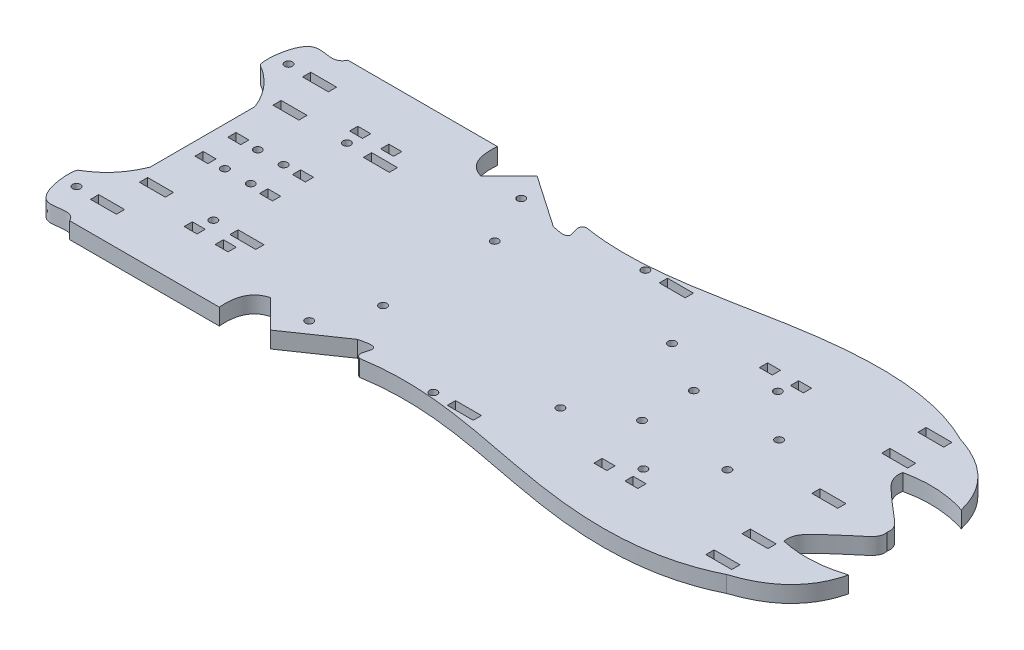
from build123d import *

# Parameters (mm, degrees)
BOSS_EXTRUDE1_DEPTH = 6.35
SKETCH3_R           = 1.5
SKETCH3_W           = 10
SKETCH3_H           = 3.175
CUT_EXTRUDE1_DEPTH  = 158.184313073
SKETCH5_W           = 5
SKETCH5_H           = 3.175
CUT_EXTRUDE2_DEPTH  = 158.184313073
SKETCH6_R           = 1.5
CUT_EXTRUDE3_DEPTH  = 158.184313073
SKETCH7_R           = 1.5
SKETCH7_W           = 10
SKETCH7_H           = 3.175
CUT_EXTRUDE4_DEPTH  = 158.184313073
SKETCH8_R           = 1.5
SKETCH8_W           = 5
SKETCH8_H           = 3.175
CUT_EXTRUDE5_DEPTH  = 158.184313073


with BuildPart() as part:
    # Sketch2 → Boss-Extrude1 (new body)
    with BuildSketch(Plane(origin=(0, 0, 0), x_dir=(1, 0, 0), z_dir=(0, 1, 0))):
        with BuildLine():
            Line((-63.840406603, 53.785068799), (-121.703241026, 53.785068799))
            add(Edge.make_bspline(
                [(-121.703241026, 53.785068799), (-123.819920355, 49.210083175), (-137.241691881, 58.423533423), (-138.26369047, 36.423372022), (-136.998583021, 35.221213289)],
                knots=[0, 0, 0, 0, 0.398285644, 1, 1, 1, 1], degree=3))
            add(Edge.make_bspline(
                [(-136.998583021, 35.221213289), (-127.88549748, 29.911265708), (-124.104675839, 20.253417254)],
                knots=[0, 0, 0, 1, 1, 1], degree=2))
            Line((-124.104675839, 20.253417254), (-124.104675839, -20.253417254))
            add(Edge.make_bspline(
                [(-136.998583021, -35.221213289), (-127.88549748, -29.911265708), (-124.104675839, -20.253417254)],
                knots=[0, 0, 0, 1, 1, 1], degree=2))
            add(Edge.make_bspline(
                [(-121.703241026, -53.785068799), (-123.819920355, -49.210083175), (-137.241691881, -58.423533423), (-138.26369047, -36.423372022), (-136.998583021, -35.221213289)],
                knots=[0, 0, 0, 0, 0.398285644, 1, 1, 1, 1], degree=3))
            Line((-121.703241026, -53.785068799), (-63.840406603, -53.785068799))
            add(Edge.make_bspline(
                [(-57.115781708, -40.699265908), (-64.807976148, -42.813184771), (-63.840406603, -53.785068799)],
                knots=[0, 0, 0, 1, 1, 1], degree=2))
            Line((-57.115781708, -40.699265908), (-46.309635168, -51.597792498))
            Line((-46.309635168, -51.597792498), (-26.261962572, -37.823631127))
            add(Edge.make_bspline(
                [(-19.55447883, -43.838791847), (-24.344879992, -42.167651215), (-14.250336762, -34.782636199), (-26.261962572, -37.823631127)],
                knots=[0, 0, 0, 0, 1, 1, 1, 1], degree=3))
            add(Edge.make_bspline(
                [(123.757273008, -45.270242074), (104.087590493, -55.130079971), (53.546875396, -54.438380733), (7.18703234, -39.374307215), (-19.55447883, -43.838791847)],
                knots=[0, 0, 0, 0, 0.449954768, 1, 1, 1, 1], degree=3))
            add(Edge.make_bspline(
                [(147.559317256, -21.799462681), (143.472760055, -38.985173762), (123.757273008, -45.270242074)],
                knots=[0, 0, 0, 1, 1, 1], degree=2))
            add(Edge.make_bspline(
                [(123.757273008, -22.991351993), (135.666095504, -25.641892918), (147.559317256, -21.799462681)],
                knots=[0, 0, 0, 1, 1, 1], degree=2))
            add(Edge.make_bspline(
                [(140.662042739, 0), (141.38719629, -2.761069346), (135.736494125, -7.354188949), (128.693355786, -13.506295653), (122.935458325, -18.932494165), (123.757273008, -22.991351993)],
                knots=[0, 0, 0, 0, 0.249977057, 0.654822336, 1, 1, 1, 1], degree=3))
            add(Edge.make_bspline(
                [(140.662042739, 0), (141.38719629, 2.761069346), (135.736494125, 7.354188949), (128.693355786, 13.506295653), (122.935458325, 18.932494165), (123.757273008, 22.991351993)],
                knots=[0, 0, 0, 0, 0.249977057, 0.654822336, 1, 1, 1, 1], degree=3))
            add(Edge.make_bspline(
                [(123.757273008, 22.991351993), (135.666095504, 25.641892918), (147.559317256, 21.799462681)],
                knots=[0, 0, 0, 1, 1, 1], degree=2))
            add(Edge.make_bspline(
                [(147.559317256, 21.799462681), (143.472760055, 38.985173762), (123.757273008, 45.270242074)],
                knots=[0, 0, 0, 1, 1, 1], degree=2))
            add(Edge.make_bspline(
                [(123.757273008, 45.270242074), (104.087590493, 55.130079971), (53.546875396, 54.438380733), (7.18703234, 39.374307215), (-19.55447883, 43.838791847)],
                knots=[0, 0, 0, 0, 0.449954768, 1, 1, 1, 1], degree=3))
            add(Edge.make_bspline(
                [(-19.55447883, 43.838791847), (-24.344879992, 42.167651215), (-14.250336762, 34.782636199), (-26.261962572, 37.823631127)],
                knots=[0, 0, 0, 0, 1, 1, 1, 1], degree=3))
            Line((-26.261962572, 37.823631127), (-46.309635168, 51.597792498))
            Line((-46.309635168, 51.597792498), (-57.115781708, 40.699265908))
            add(Edge.make_bspline(
                [(-57.115781708, 40.699265908), (-64.807976148, 42.813184771), (-63.840406603, 53.785068799)],
                knots=[0, 0, 0, 1, 1, 1], degree=2))
        make_face()
    extrude(amount=BOSS_EXTRUDE1_DEPTH)

    # Sketch3 → Cut-Extrude1 (cut, through all)
    with BuildSketch(Plane(origin=(0, 6.35, 0), x_dir=(1, 0, 0), z_dir=(0, 1, 0))):
        with Locations(Location((6.160337598, 41, 0), (0, 0, 270))):
            Circle(SKETCH3_R)
        with Locations(Location((-41.839662402, 41, 0), (0, 0, 270))):
            Circle(SKETCH3_R)
        with Locations(Location((-131.839662402, 41, 0), (0, 0, 270))):
            Circle(SKETCH3_R)
        with Locations(Location((6.160337598, -41, 0), (0, 0, 90))):
            Circle(SKETCH3_R)
        with Locations(Location((-41.839662402, -41, 0), (0, 0, 90))):
            Circle(SKETCH3_R)
        with Locations(Location((-131.839662402, -41, 0), (0, 0, 90))):
            Circle(SKETCH3_R)
        with Locations((118.160337598, 41)):
            Rectangle(SKETCH3_W, SKETCH3_H)
        with Locations((18.160337598, 41)):
            Rectangle(SKETCH3_W, SKETCH3_H)
        with Locations((-119.839662402, 41)):
            Rectangle(SKETCH3_W, SKETCH3_H)
        with Locations((-119.839662402, -41)):
            Rectangle(SKETCH3_W, SKETCH3_H)
        with Locations((18.160337598, -41)):
            Rectangle(SKETCH3_W, SKETCH3_H)
        with Locations((118.160337598, -41)):
            Rectangle(SKETCH3_W, SKETCH3_H)
        with Locations((118.160337598, 0)):
            Rectangle(SKETCH3_W, SKETCH3_H)
        with Locations((118.160337598, 27)):
            Rectangle(SKETCH3_W, SKETCH3_H)
        with Locations((118.160337598, -27)):
            Rectangle(SKETCH3_W, SKETCH3_H)
    extrude(amount=-CUT_EXTRUDE1_DEPTH, mode=Mode.SUBTRACT)

    # Sketch5 → Cut-Extrude2 (cut, through all)
    with BuildSketch(Plane(origin=(0, 6.35, 0), x_dir=(1, 0, 0), z_dir=(0, 1, 0))):
        with Locations((63.360337601, 32)):
            Rectangle(SKETCH5_W, SKETCH5_H)
        with Locations((75.360337601, 32)):
            Rectangle(SKETCH5_W, SKETCH5_H)
        with Locations((-95.134675839, 32)):
            Rectangle(SKETCH5_W, SKETCH5_H)
        with Locations((-83.134675839, 32)):
            Rectangle(SKETCH5_W, SKETCH5_H)
        with Locations((75.360337601, -32)):
            Rectangle(SKETCH5_W, SKETCH5_H)
        with Locations((63.360337601, -32)):
            Rectangle(SKETCH5_W, SKETCH5_H)
        with Locations((-83.134675839, -32)):
            Rectangle(SKETCH5_W, SKETCH5_H)
        with Locations((-95.134675839, -32)):
            Rectangle(SKETCH5_W, SKETCH5_H)
    extrude(amount=-CUT_EXTRUDE2_DEPTH, mode=Mode.SUBTRACT)

    # Sketch6 → Cut-Extrude3 (cut, through all)
    with BuildSketch(Plane(origin=(0, 6.35, 0), x_dir=(1, 0, 0), z_dir=(0, 1, 0))):
        with Locations(Location((55.895324161, 10, 0), (0, 0, 270))):
            Circle(SKETCH6_R)
        with Locations(Location((88.895324161, 10, 0), (0, 0, 270))):
            Circle(SKETCH6_R)
        with Locations(Location((72.395324161, 26, 0), (0, 0, 270))):
            Circle(SKETCH6_R)
        with Locations(Location((88.895324161, -10, 0), (0, 0, 90))):
            Circle(SKETCH6_R)
        with Locations(Location((55.895324161, -10, 0), (0, 0, 90))):
            Circle(SKETCH6_R)
        with Locations(Location((72.395324161, -26, 0), (0, 0, 90))):
            Circle(SKETCH6_R)
        with Locations(Location((35.895324161, 21.59, 0), (0, 0, 270))):
            Circle(SKETCH6_R)
        with Locations(Location((35.895324161, -21.59, 0), (0, 0, 90))):
            Circle(SKETCH6_R)
        with Locations(Location((-32.684675839, -21.59, 0), (0, 0, 270))):
            Circle(SKETCH6_R)
        with Locations(Location((-32.684675839, 21.59, 0), (0, 0, 90))):
            Circle(SKETCH6_R)
    extrude(amount=-CUT_EXTRUDE3_DEPTH, mode=Mode.SUBTRACT)

    # Sketch7 → Cut-Extrude4 (cut, through all)
    with BuildSketch(Plane(origin=(0, 6.35, 0), x_dir=(1, 0, 0), z_dir=(0, 1, 0))):
        with Locations(Location((-94.104675839, 25.825, 0), (0, 0, 270))):
            Circle(SKETCH7_R)
        with Locations(Location((-94.104675839, -25.825, 0), (0, 0, 90))):
            Circle(SKETCH7_R)
        with Locations((-116.104675839, 25.825)):
            Rectangle(SKETCH7_W, SKETCH7_H)
        with Locations((-81.104675839, 25.825)):
            Rectangle(SKETCH7_W, SKETCH7_H)
        with Locations((-81.104675839, -25.825)):
            Rectangle(SKETCH7_W, SKETCH7_H)
        with Locations((-116.104675839, -25.825)):
            Rectangle(SKETCH7_W, SKETCH7_H)
    extrude(amount=-CUT_EXTRUDE4_DEPTH, mode=Mode.SUBTRACT)

    # Sketch8 → Cut-Extrude5 (cut, through all)
    with BuildSketch(Plane(origin=(0, 6.35, 0), x_dir=(1, 0, 0), z_dir=(0, 1, 0))):
        with Locations(Location((-109.104675839, 6.35, 0), (0, 0, 270))):
            Circle(SKETCH8_R)
        with Locations(Location((-99.104675839, 6.35, 0), (0, 0, 90))):
            Circle(SKETCH8_R)
        with Locations(Location((-99.104675839, -6.35, 0), (0, 0, 270))):
            Circle(SKETCH8_R)
        with Locations(Location((-109.104675839, -6.35, 0), (0, 0, 90))):
            Circle(SKETCH8_R)
        with Locations((-116.604675839, 6.35)):
            Rectangle(SKETCH8_W, SKETCH8_H)
        with Locations((-91.604675839, 6.35)):
            Rectangle(SKETCH8_W, SKETCH8_H)
        with Locations((-91.604675839, -6.35)):
            Rectangle(SKETCH8_W, SKETCH8_H)
        with Locations((-116.604675839, -6.35)):
            Rectangle(SKETCH8_W, SKETCH8_H)
    extrude(amount=-CUT_EXTRUDE5_DEPTH, mode=Mode.SUBTRACT)


solid = part.part
